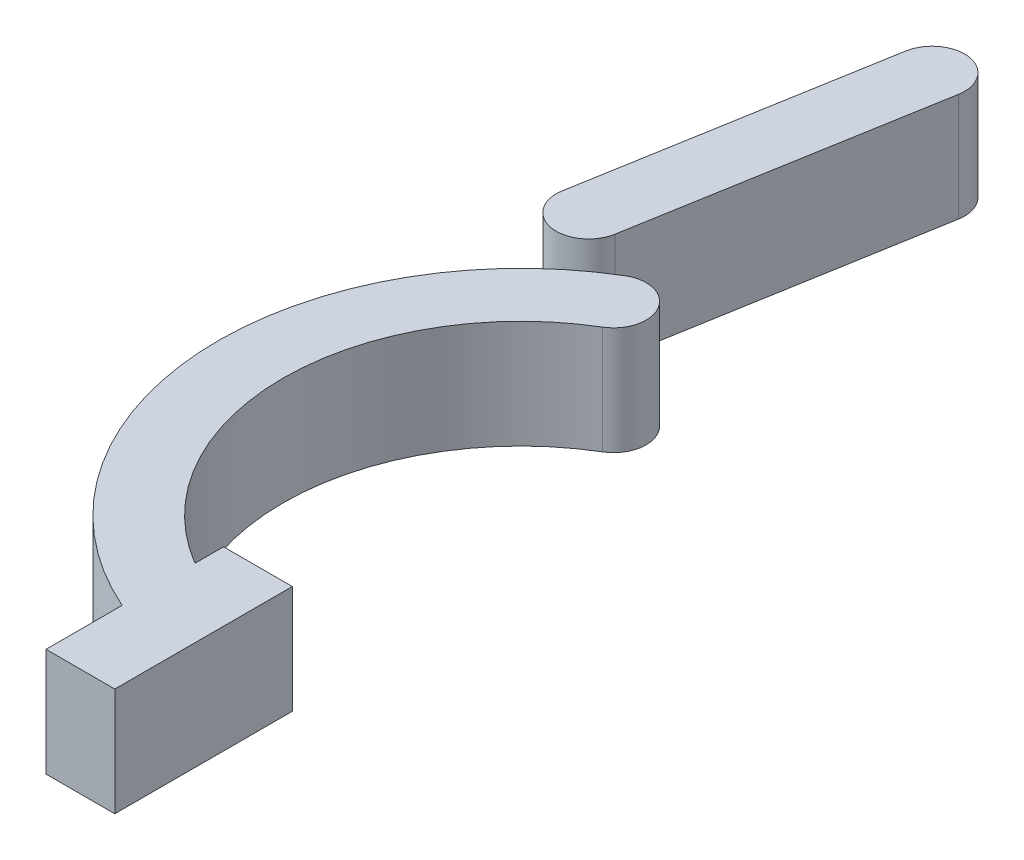
from build123d import *

# Parameters (mm, degrees)
BOSS_EXTRUDE1_DEPTH   = 5
BOSS_EXTRUDE1_2_DEPTH = 5


with BuildPart() as part:
    # Sketch1 → Boss-Extrude1 (new, symmetric)
    with BuildSketch(Plane(origin=(0, 0, 0), x_dir=(1, 0, 0), z_dir=(0, 1, 0))):
        with BuildLine():
            ThreePointArc((-9.543857098, -7.923381826), (-11.988903978, -4.456142902), (-15.456142902, -6.901189781))
            Line((-15.456142902, -6.901189781), (-20.141189773, -33.999166382))
            ThreePointArc((-20.141189773, -33.999166382), (-17.696142893, -37.466405306), (-14.228903969, -35.021358426))
            Line((-14.228903969, -35.021358426), (-9.543857098, -7.923381826))
        make_face()
    extrude(amount=BOSS_EXTRUDE1_DEPTH, both=True)


with BuildPart() as body_2:
    # Sketch1 → Boss-Extrude1 2 (new, symmetric)
    with BuildSketch(Plane(origin=(0, 0, 0), x_dir=(1, 0, 0), z_dir=(0, 1, 0))):
        with BuildLine():
            Line((-0.926080019, -78.185358395), (-7.289022858, -78.185358395))
            Line((-7.289022858, -78.185358395), (-7.289022858, -80.829934279))
            ThreePointArc((-7.289022858, -80.829934279), (-18.053822992, -61.956577017), (-7.360273261, -43.042758513))
            ThreePointArc((-7.360273261, -43.042758513), (-6.328556235, -38.927474808), (-10.443839941, -37.895757782))
            ThreePointArc((-10.443839941, -37.895757782), (-23.997545105, -63.690081893), (-7.289022858, -87.562144316))
            Line((-7.289022858, -87.562144316), (-7.289022858, -94.612139396))
            Line((-7.289022858, -94.612139396), (-0.926080019, -94.612139396))
            Line((-0.926080019, -94.612139396), (-0.926080019, -78.185358395))
        make_face()
    extrude(amount=BOSS_EXTRUDE1_2_DEPTH, both=True)


solid = Compound([part.part, body_2.part])
